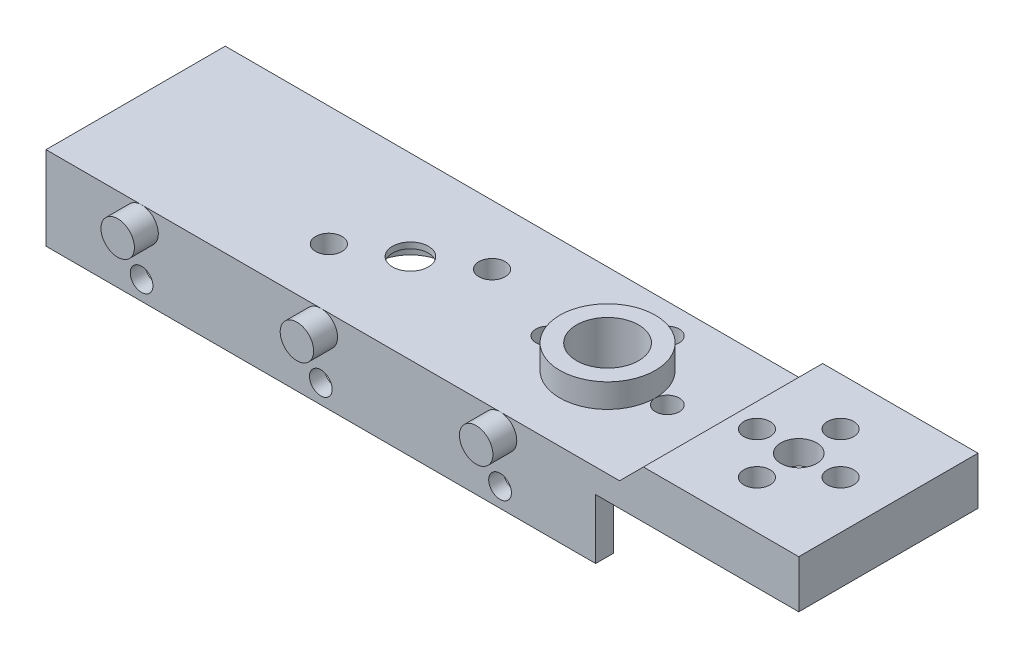
from build123d import *

# Parameters (mm, degrees)
SKETCH_1_W          = 63
SKETCH_1_H          = 15
SKETCH_1_R          = 1.1
SKETCH_1_R_2        = 1
SKETCH_1_R_3        = 1.5
SKETCH_1_R_4        = 2.6
EXTRUDE_1_DEPTH     = 2
SKETCH_2_R          = 1.4
EXTRUDE_2_DEPTH     = 2
SKETCH_3_R          = 3
CUT_EXTRUDE_1_DEPTH = 1.5
SKETCH_4_W          = 46
SKETCH_4_H          = 1.5
EXTRUDE_3_DEPTH     = 5
SKETCH_2_3_R        = 0.95
CUT_EXTRUDE_2_DEPTH = 1.5
CUT_EXTRUDE_3_DEPTH = 0.25
SKETCH_1_7_W        = 15
SKETCH_1_7_H        = 15
SKETCH_1_7_R        = 1.5
SKETCH_1_7_R_2      = 1.1
EXTRUDE_4_DEPTH     = 4
SKETCH_1_8_R        = 6
SKETCH_1_8_R_2      = 1.5
SKETCH_1_8_R_3      = 1.1
CUT_EXTRUDE_4_DEPTH = 2
CUT_EXTRUDE_5_DEPTH = 15
SKETCH_1_9_R        = 4
SKETCH_1_9_R_2      = 2.6
EXTRUDE_5_DEPTH     = 4


with BuildPart() as part:
    # 草图1 → 凸台-拉伸1 (new body)
    with BuildSketch(Plane(origin=(0, 0, 0), x_dir=(1, 0, 0), z_dir=(0, 1, 0))):
        Rectangle(SKETCH_1_W, SKETCH_1_H)
        with Locations(Location((-12.830127019, -2.5, 0), (0, 0, 270))):
            Circle(SKETCH_1_R, mode=Mode.SUBTRACT)
        with Locations(Location((3, 0, 0), (0, 0, 270))):
            Circle(SKETCH_1_R_2, mode=Mode.SUBTRACT)
        with Locations(Location((13, 0, 0), (0, 0, 270))):
            Circle(SKETCH_1_R_2, mode=Mode.SUBTRACT)
        with Locations(Location((-8.5, 0, 0), (0, 0, 270))):
            Circle(SKETCH_1_R_3, mode=Mode.SUBTRACT)
        with Locations(Location((-4.169872981, 2.5, 0), (0, 0, 270))):
            Circle(SKETCH_1_R, mode=Mode.SUBTRACT)
        with Locations(Location((8, 5, 0), (0, 0, 270))):
            Circle(SKETCH_1_R_2, mode=Mode.SUBTRACT)
        with Locations(Location((8, 0, 0), (0, 0, 270))):
            Circle(SKETCH_1_R_4, mode=Mode.SUBTRACT)
        with Locations(Location((24, 3.5, 0), (0, 0, 270))):
            Circle(SKETCH_1_R, mode=Mode.SUBTRACT)
        with Locations(Location((24, -3.5, 0), (0, 0, 270))):
            Circle(SKETCH_1_R, mode=Mode.SUBTRACT)
        with Locations(Location((20.5, 0, 0), (0, 0, 270))):
            Circle(SKETCH_1_R, mode=Mode.SUBTRACT)
        with Locations(Location((24, 0, 0), (0, 0, 270))):
            Circle(SKETCH_1_R_3, mode=Mode.SUBTRACT)
        with Locations(Location((27.5, 0, 0), (0, 0, 270))):
            Circle(SKETCH_1_R, mode=Mode.SUBTRACT)
    extrude(amount=EXTRUDE_1_DEPTH)

    # 草图2 → 凸台-拉伸2 (add)
    with BuildSketch(Plane.XY.offset(7.5)):
        with Locations(Location((-23.5, 0.6, 0), (0, 0, 205.376933525))):
            Circle(SKETCH_2_R)
        with Locations(Location((-8.5, 0.6, 0), (0, 0, 205.376933525))):
            Circle(SKETCH_2_R)
        with Locations(Location((6.5, 0.6, 0), (0, 0, 205.376933525))):
            Circle(SKETCH_2_R)
    extrude(amount=EXTRUDE_2_DEPTH)

    # 草图3 → 切除-拉伸1 (cut)
    with BuildSketch(Plane.XZ):
        with Locations(Location((-8.5, 0, 0), (0, 0, 270))):
            Circle(SKETCH_3_R)
    extrude(amount=-CUT_EXTRUDE_1_DEPTH, mode=Mode.SUBTRACT)

    # 草图4 → 凸台-拉伸3 (add)
    with BuildSketch(Plane.XZ):
        with Locations((-8.5, 6.75)):
            Rectangle(SKETCH_4_W, SKETCH_4_H)
    extrude(amount=EXTRUDE_3_DEPTH)

    # 草图2<3> → 切除-拉伸2 (cut)
    with BuildSketch(Plane.XY.offset(7.5)):
        with Locations((-23.5, -3.4)):
            Circle(SKETCH_2_3_R)
        with Locations((-8.5, -3.4)):
            Circle(SKETCH_2_3_R)
        with Locations((6.5, -3.4)):
            Circle(SKETCH_2_3_R)
    extrude(amount=-CUT_EXTRUDE_2_DEPTH, mode=Mode.SUBTRACT)

    # 草图5 → 切除-拉伸3 (cut)
    with BuildSketch(Plane(origin=(0, 0, 6), x_dir=(-1, 0, 0), z_dir=(0, 0, -1))):
        Polygon((22.403034489, -1.5), (24.596965511, -1.5), (25.693931023, -3.4), (24.596965511, -5.3), (22.403034489, -5.3), (21.306068977, -3.4), align=None)
        Polygon((6.306068977, -3.4), (7.403034489, -1.5), (9.596965511, -1.5), (10.693931023, -3.4), (9.596965511, -5.3), (7.403034489, -5.3), align=None)
        Polygon((-8.693931023, -3.4), (-7.596965511, -1.5), (-5.403034489, -1.5), (-4.306068977, -3.4), (-5.403034489, -5.3), (-7.596965511, -5.3), align=None)
    extrude(amount=-CUT_EXTRUDE_3_DEPTH, mode=Mode.SUBTRACT)

    # 草图1<7> → 凸台-拉伸4 (add)
    with BuildSketch(Plane(origin=(0, 0, 0), x_dir=(1, 0, 0), z_dir=(0, 1, 0))):
        with Locations((24, 0)):
            Rectangle(SKETCH_1_7_W, SKETCH_1_7_H)
        with Locations(Location((24, 0, 0), (0, 0, 270))):
            Circle(SKETCH_1_7_R, mode=Mode.SUBTRACT)
        with Locations(Location((27.5, 0, 0), (0, 0, 270))):
            Circle(SKETCH_1_7_R_2, mode=Mode.SUBTRACT)
        with Locations(Location((24, -3.5, 0), (0, 0, 270))):
            Circle(SKETCH_1_7_R_2, mode=Mode.SUBTRACT)
        with Locations(Location((20.5, 0, 0), (0, 0, 270))):
            Circle(SKETCH_1_7_R_2, mode=Mode.SUBTRACT)
        with Locations(Location((24, 3.5, 0), (0, 0, 270))):
            Circle(SKETCH_1_7_R_2, mode=Mode.SUBTRACT)
    extrude(amount=EXTRUDE_4_DEPTH)

    # 草图1<8> → 切除-拉伸4 (cut)
    with BuildSketch(Plane(origin=(0, 0, 0), x_dir=(1, 0, 0), z_dir=(0, 1, 0))):
        with Locations(Location((24, 0, 0), (0, 0, 270))):
            Circle(SKETCH_1_8_R)
        with Locations(Location((24, 0, 0), (0, 0, 270))):
            Circle(SKETCH_1_8_R_2, mode=Mode.SUBTRACT)
        with Locations(Location((27.5, 0, 0), (0, 0, 270))):
            Circle(SKETCH_1_8_R_3, mode=Mode.SUBTRACT)
        with Locations(Location((24, -3.5, 0), (0, 0, 270))):
            Circle(SKETCH_1_8_R_3, mode=Mode.SUBTRACT)
        with Locations(Location((20.5, 0, 0), (0, 0, 270))):
            Circle(SKETCH_1_8_R_3, mode=Mode.SUBTRACT)
        with Locations(Location((24, 3.5, 0), (0, 0, 270))):
            Circle(SKETCH_1_8_R_3, mode=Mode.SUBTRACT)
    extrude(amount=CUT_EXTRUDE_4_DEPTH, mode=Mode.SUBTRACT)

    # 草图6 → 切除-拉伸5 (cut)
    with BuildSketch(Plane(origin=(0, 0, -7.5), x_dir=(-1, 0, 0), z_dir=(0, 0, -1))):
        Polygon((-16.5, 2), (-18.5, 4), (-16.5, 4), align=None)
    extrude(amount=-CUT_EXTRUDE_5_DEPTH, mode=Mode.SUBTRACT)

    # 草图1<9> → 凸台-拉伸5 (add)
    with BuildSketch(Plane(origin=(0, 0, 0), x_dir=(1, 0, 0), z_dir=(0, 1, 0))):
        with Locations(Location((8, 0, 0), (0, 0, 89.999818815))):
            Circle(SKETCH_1_9_R)
        with Locations(Location((8, 0, 0), (0, 0, 270))):
            Circle(SKETCH_1_9_R_2, mode=Mode.SUBTRACT)
    extrude(amount=EXTRUDE_5_DEPTH)


solid = part.part
